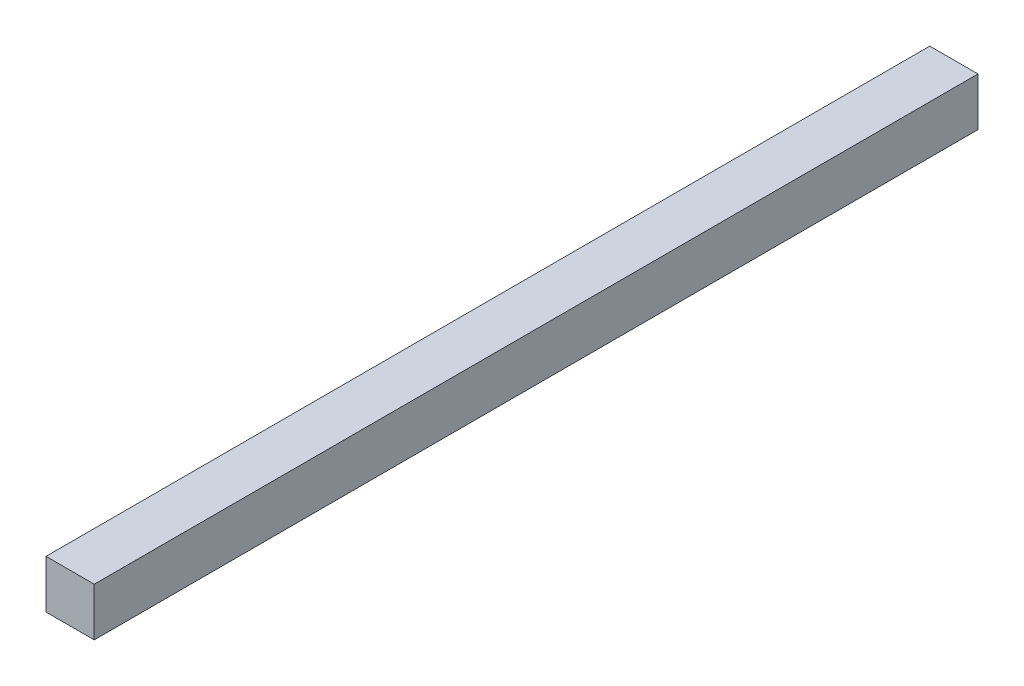
from build123d import *

# Parameters (mm, degrees)
CROQUIS1_W              = 12.7
CROQUIS1_H              = 12.7
SALIENTE_EXTRUIR1_DEPTH = 116.35


with BuildPart() as part:
    # Croquis1 → Saliente-Extruir1 (new, symmetric)
    with BuildSketch(Plane.XY):
        Rectangle(CROQUIS1_W, CROQUIS1_H)
    extrude(amount=SALIENTE_EXTRUIR1_DEPTH, both=True)


solid = part.part
